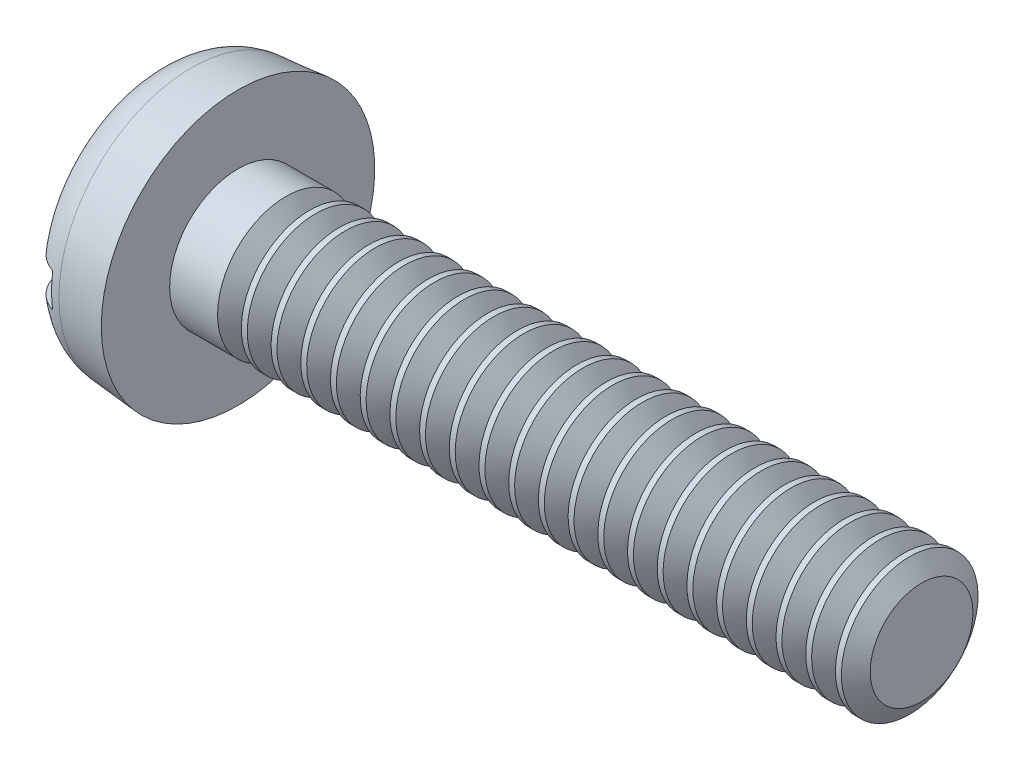
from build123d import *

# Parameters (mm, degrees)
FILLET2_R       = 0.5
SKETCH2_W       = 3.2
SKETCH2_H       = 0.4
SLOT_DEPTH      = 0.35
THDSCHPAT_COUNT = 22
THDSCHPAT_PITCH = 0.347619048


with BuildPart() as part:
    # BodySke → Base-Revolve (revolve)
    with BuildSketch(Plane.XY, mode=Mode.PRIVATE) as base_revolve_sk:
        Polygon((1, 0.8), (1, 1.6), (0, 1.512511336), (0, 0), (9, 0), (9, 0.8), align=None)
    revolve(base_revolve_sk.sketch.rotate(Axis((-25.4, 0, 0), (1, 0, 0)), 90), axis=Axis((-25.4, 0, 0), (1, 0, 0)))

    # Fillet2
    fillet2_edges = [part.edges().sort_by_distance(p)[0] for p in [
        (0, 0, -1.512511336),
    ]]
    fillet(fillet2_edges, radius=FILLET2_R)

    # Sketch2 → Slot (cut)
    with BuildSketch(Plane(origin=(0, 0, 0), x_dir=(0, 0, -1), z_dir=(1, 0, 0))):
        Rectangle(SKETCH2_W, SKETCH2_H)
    extrude(amount=SLOT_DEPTH, mode=Mode.SUBTRACT)

    # ThdSchSke → ThreadSchematic (revolve, cut)
    with BuildSketch(Plane.XY):
        Polygon((1.7, -0.601), (1.5606587, -0.8), (1.5606587, -1), (1.8393413, -1), (1.8393413, -0.8), align=None)
    threadschematic = revolve(axis=Axis((-3.175, 0, 0), (1, 0, 0)), mode=Mode.SUBTRACT)

    # ThdSchPat: ThreadSchematic ×22
    with Locations(*[(i * THDSCHPAT_PITCH, 0, 0) for i in range(1, THDSCHPAT_COUNT)]):
        add(threadschematic, mode=Mode.SUBTRACT)


solid = part.part
